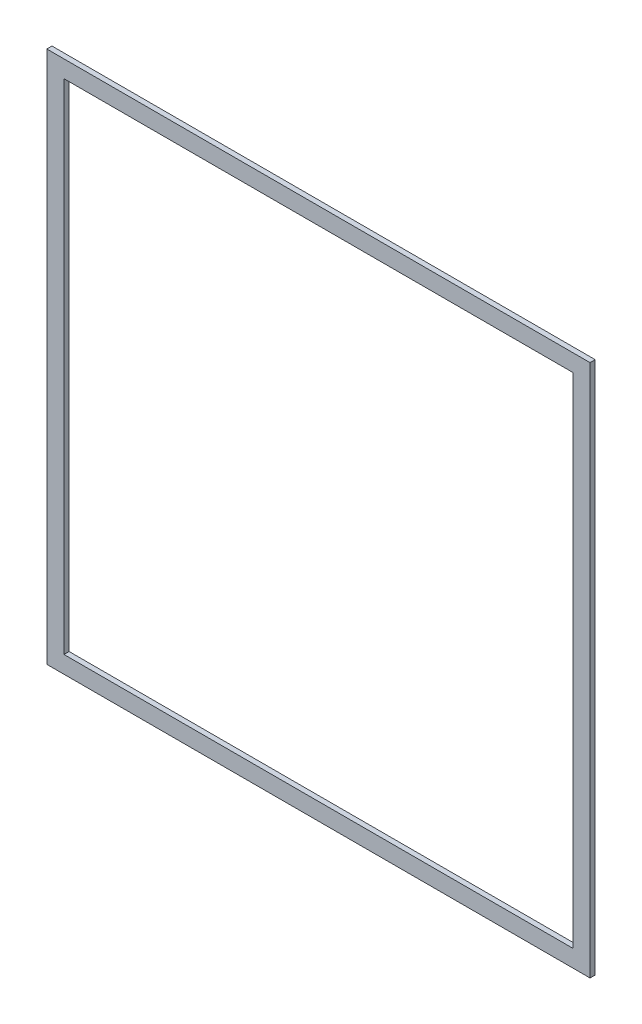
from build123d import *

# Parameters (mm, degrees)
SKETCH1_W           = 296.8
SKETCH1_H           = 290.8
BOSS_EXTRUDE1_DEPTH = 3


with BuildPart() as part:
    # Sketch1 → Boss-Extrude1 (new body)
    with BuildSketch(Plane.XY):
        Polygon((0, 0), (0, 310.8), (316.8, 310.8), (316.8, 0), (314.33758003, 0), (10, 0), align=None)
        with Locations((158.4, 155.4)):
            Rectangle(SKETCH1_W, SKETCH1_H, mode=Mode.SUBTRACT)
    extrude(amount=BOSS_EXTRUDE1_DEPTH)


solid = part.part
